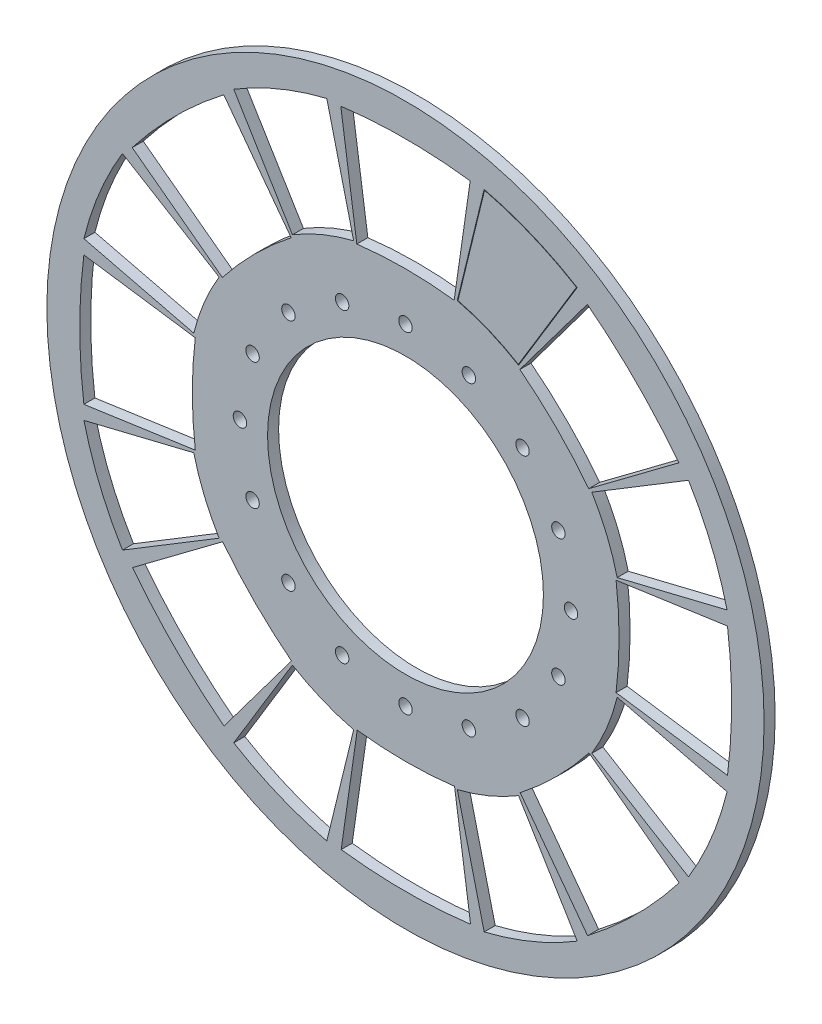
from build123d import *

# Parameters (mm, degrees)
SKETCH1_R           = 325
SKETCH1_R_2         = 125
SKETCH1_R_3         = 6.1
BOSS_EXTRUDE1_DEPTH = 10
BOSS_EXTRUDE2_DEPTH = 10
CUT_EXTRUDE1_DEPTH  = 10


with BuildPart() as part:
    # Sketch1 → Boss-Extrude1 (new body)
    with BuildSketch(Plane.XY):
        Circle(SKETCH1_R)
        Circle(SKETCH1_R_2, mode=Mode.SUBTRACT)
        with Locations((0, 150)):
            Circle(SKETCH1_R_3, mode=Mode.SUBTRACT)
        with Locations((57.402514855, 138.581929877)):
            Circle(SKETCH1_R_3, mode=Mode.SUBTRACT)
        with Locations((106.066017178, 106.066017178)):
            Circle(SKETCH1_R_3, mode=Mode.SUBTRACT)
        with Locations((138.581929877, 57.402514855)):
            Circle(SKETCH1_R_3, mode=Mode.SUBTRACT)
        with Locations((150, 0)):
            Circle(SKETCH1_R_3, mode=Mode.SUBTRACT)
        with Locations((138.581929877, -57.402514855)):
            Circle(SKETCH1_R_3, mode=Mode.SUBTRACT)
        with Locations((106.066017178, -106.066017178)):
            Circle(SKETCH1_R_3, mode=Mode.SUBTRACT)
        with Locations((57.402514855, -138.581929877)):
            Circle(SKETCH1_R_3, mode=Mode.SUBTRACT)
        with Locations((0, -150)):
            Circle(SKETCH1_R_3, mode=Mode.SUBTRACT)
        with Locations((-57.402514855, -138.581929877)):
            Circle(SKETCH1_R_3, mode=Mode.SUBTRACT)
        with Locations((-106.066017178, -106.066017178)):
            Circle(SKETCH1_R_3, mode=Mode.SUBTRACT)
        with Locations((-138.581929877, -57.402514855)):
            Circle(SKETCH1_R_3, mode=Mode.SUBTRACT)
        with Locations((-150, 0)):
            Circle(SKETCH1_R_3, mode=Mode.SUBTRACT)
        with Locations((-138.581929877, 57.402514855)):
            Circle(SKETCH1_R_3, mode=Mode.SUBTRACT)
        with Locations((-106.066017178, 106.066017178)):
            Circle(SKETCH1_R_3, mode=Mode.SUBTRACT)
        with Locations((-57.402514855, 138.581929877)):
            Circle(SKETCH1_R_3, mode=Mode.SUBTRACT)
        with BuildLine():
            Line((46.942963734, 191.840058788), (71.305767698, 291.402620944))
            ThreePointArc((71.305767698, 291.402620944), (114.80502971, 277.163859753), (155.631977448, 256.473561202))
            Line((155.631977448, 256.473561202), (102.457718487, 168.845094458))
            ThreePointArc((102.457718487, 168.845094458), (75.579977892, 182.466207671), (46.942963734, 191.840058788))
        make_face(mode=Mode.SUBTRACT)
        with BuildLine():
            Line((191.840058788, 46.942963734), (291.402620944, 71.305767698))
            ThreePointArc((291.402620944, 71.305767698), (277.163859753, 114.80502971), (256.473561202, 155.631977448))
            Line((256.473561202, 155.631977448), (168.845094458, 102.457718487))
            ThreePointArc((168.845094458, 102.457718487), (182.466207671, 75.579977892), (191.840058788, 46.942963734))
        make_face(mode=Mode.SUBTRACT)
        with BuildLine():
            Line((168.845094458, -102.457718487), (256.473561202, -155.631977448))
            ThreePointArc((256.473561202, -155.631977448), (277.163859753, -114.80502971), (291.402620944, -71.305767698))
            Line((291.402620944, -71.305767698), (191.840058788, -46.942963734))
            ThreePointArc((191.840058788, -46.942963734), (182.466207671, -75.579977892), (168.845094458, -102.457718487))
        make_face(mode=Mode.SUBTRACT)
        with BuildLine():
            Line((46.942963734, -191.840058788), (71.305767698, -291.402620944))
            ThreePointArc((71.305767698, -291.402620944), (114.80502971, -277.163859753), (155.631977448, -256.473561202))
            Line((155.631977448, -256.473561202), (102.457718487, -168.845094458))
            ThreePointArc((102.457718487, -168.845094458), (75.579977892, -182.466207671), (46.942963734, -191.840058788))
        make_face(mode=Mode.SUBTRACT)
        with BuildLine():
            Line((-102.457718487, -168.845094458), (-155.631977448, -256.473561202))
            ThreePointArc((-155.631977448, -256.473561202), (-114.80502971, -277.163859753), (-71.305767698, -291.402620944))
            Line((-71.305767698, -291.402620944), (-46.942963734, -191.840058788))
            ThreePointArc((-46.942963734, -191.840058788), (-75.579977892, -182.466207671), (-102.457718487, -168.845094458))
        make_face(mode=Mode.SUBTRACT)
        with BuildLine():
            Line((-191.840058788, -46.942963734), (-291.402620944, -71.305767698))
            ThreePointArc((-291.402620944, -71.305767698), (-277.163859753, -114.80502971), (-256.473561202, -155.631977448))
            Line((-256.473561202, -155.631977448), (-168.845094458, -102.457718487))
            ThreePointArc((-168.845094458, -102.457718487), (-182.466207671, -75.579977892), (-191.840058788, -46.942963734))
        make_face(mode=Mode.SUBTRACT)
        with BuildLine():
            Line((-168.845094458, 102.457718487), (-256.473561202, 155.631977448))
            ThreePointArc((-256.473561202, 155.631977448), (-277.163859753, 114.80502971), (-291.402620944, 71.305767698))
            Line((-291.402620944, 71.305767698), (-191.840058788, 46.942963734))
            ThreePointArc((-191.840058788, 46.942963734), (-182.466207671, 75.579977892), (-168.845094458, 102.457718487))
        make_face(mode=Mode.SUBTRACT)
        with BuildLine():
            Line((-46.942963734, 191.840058788), (-71.305767698, 291.402620944))
            ThreePointArc((-71.305767698, 291.402620944), (-114.80502971, 277.163859753), (-155.631977448, 256.473561202))
            Line((-155.631977448, 256.473561202), (-102.457718487, 168.845094458))
            ThreePointArc((-102.457718487, 168.845094458), (-75.579977892, 182.466207671), (-46.942963734, 191.840058788))
        make_face(mode=Mode.SUBTRACT)
    extrude(amount=BOSS_EXTRUDE1_DEPTH)

    # Sketch3 → Cut-Extrude1 (cut)
    with BuildSketch(Plane(origin=(0, 0, 0), x_dir=(-1, 0, 0), z_dir=(0, 0, -1))):
        with BuildLine():
            Line((58.634644714, 291.703427262), (44.100311487, 190.728521236))
            ThreePointArc((44.100311487, 190.728521236), (0, 193.447505004), (-44.100311487, 190.728521236))
            Line((-44.100311487, 190.728521236), (-58.634644714, 291.703427262))
            ThreePointArc((-58.634644714, 291.703427262), (0, 295.447505004), (58.634644714, 291.703427262))
        make_face()
        with BuildLine():
            Line((247.621030589, 164.69912081), (165.943664224, 103.576405615))
            ThreePointArc((165.943664224, 103.576405615), (136.68264678, 136.68264678), (103.576405615, 165.943664224))
            Line((103.576405615, 165.943664224), (164.69912081, 247.621030589))
            ThreePointArc((164.69912081, 247.621030589), (208.807538461, 208.807538461), (247.621030589, 164.69912081))
        make_face()
        with BuildLine():
            Line((291.448979263, -58.740040526), (190.474073237, -44.205707299))
            ThreePointArc((190.474073237, -44.205707299), (193.193057005, -0.105395812), (190.474073237, 43.994915675))
            Line((190.474073237, 43.994915675), (291.448979263, 58.529248902))
            ThreePointArc((291.448979263, 58.529248902), (295.193057005, -0.105395812), (291.448979263, -58.740040526))
        make_face()
        with BuildLine():
            Line((164.444672811, -247.726426402), (103.321957616, -166.049060036))
            ThreePointArc((103.321957616, -166.049060036), (136.428198781, -136.788042592), (165.689216225, -103.681801427))
            Line((165.689216225, -103.681801427), (247.36658259, -164.804516623))
            ThreePointArc((247.36658259, -164.804516623), (208.553090462, -208.912934273), (164.444672811, -247.726426402))
        make_face()
        with BuildLine():
            Line((-58.994488525, -291.554375075), (-44.460155298, -190.579469049))
            ThreePointArc((-44.460155298, -190.579469049), (-0.359843811, -193.298452818), (43.740467676, -190.579469049))
            Line((43.740467676, -190.579469049), (58.274800903, -291.554375075))
            ThreePointArc((58.274800903, -291.554375075), (-0.359843811, -295.298452818), (-58.994488525, -291.554375075))
        make_face()
        with BuildLine():
            Line((-247.980874401, -164.550068624), (-166.303508035, -103.427353428))
            ThreePointArc((-166.303508035, -103.427353428), (-137.042490591, -136.533594593), (-103.936249426, -165.794612037))
            Line((-103.936249426, -165.794612037), (-165.058964622, -247.471978403))
            ThreePointArc((-165.058964622, -247.471978403), (-209.167382272, -208.658486274), (-247.980874401, -164.550068624))
        make_face()
        with BuildLine():
            Line((-291.808823074, 58.889092713), (-190.833917048, 44.354759486))
            ThreePointArc((-190.833917048, 44.354759486), (-193.552900817, 0.254447999), (-190.833917048, -43.845863488))
            Line((-190.833917048, -43.845863488), (-291.808823074, -58.380196715))
            ThreePointArc((-291.808823074, -58.380196715), (-295.552900817, 0.254447999), (-291.808823074, 58.889092713))
        make_face()
        with BuildLine():
            Line((-164.804516623, 247.875478588), (-103.681801427, 166.198112223))
            ThreePointArc((-103.681801427, 166.198112223), (-136.788042592, 136.937094779), (-166.049060036, 103.830853614))
            Line((-166.049060036, 103.830853614), (-247.726426402, 164.953568809))
            ThreePointArc((-247.726426402, 164.953568809), (-208.912934273, 209.06198646), (-164.804516623, 247.875478588))
        make_face()
    extrude(amount=-CUT_EXTRUDE1_DEPTH, mode=Mode.SUBTRACT)


with BuildPart() as body_2:
    # Sketch2 → Boss-Extrude2 (new body)
    with BuildSketch(Plane(origin=(0, 0, 0), x_dir=(-1, 0, 0), z_dir=(0, 0, -1))):
        with BuildLine():
            Line((-102.289321672, 169.531397304), (-154.944918367, 256.305135087))
            ThreePointArc((-154.944918367, 256.305135087), (-114.613687993, 276.701919987), (-71.672496585, 290.797701561))
            Line((-71.672496585, 290.797701561), (-47.547327661, 192.206273655))
            ThreePointArc((-47.547327661, 192.206273655), (-75.771319608, 182.928147437), (-102.289321672, 169.531397304))
        make_face()
    extrude(amount=-BOSS_EXTRUDE2_DEPTH)


solid = Compound([part.part, body_2.part])
